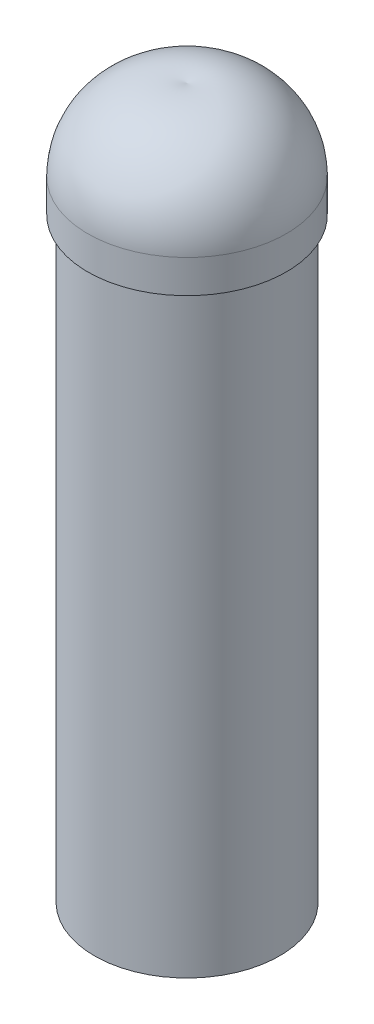
from build123d import *


with BuildPart() as part:
    # Sketch1 → Revolve1 (revolve)
    with BuildSketch(Plane.XY):
        with BuildLine():
            Line((-2.95, 13.11209092), (-2.75, 13.11209092))
            Line((-2.75, 13.11209092), (-2.75, -4.88790908))
            Line((-2.75, -4.88790908), (-1.55, -4.88790908))
            Line((-1.55, -4.88790908), (-1.55, 2.262295082))
            Line((-1.55, 2.262295082), (0.05, 2.262295082))
            Line((0.05, 2.262295082), (0.05, 16.561580663))
            ThreePointArc((0.05, 16.561580663), (-2.03113883, 16.048582593), (-2.95, 14.11209092))
            Line((-2.95, 14.11209092), (-2.95, 13.11209092))
        make_face()
    revolve(axis=Axis((0.05, 16.561580663, 0), (0, -1, 0)))


solid = part.part
